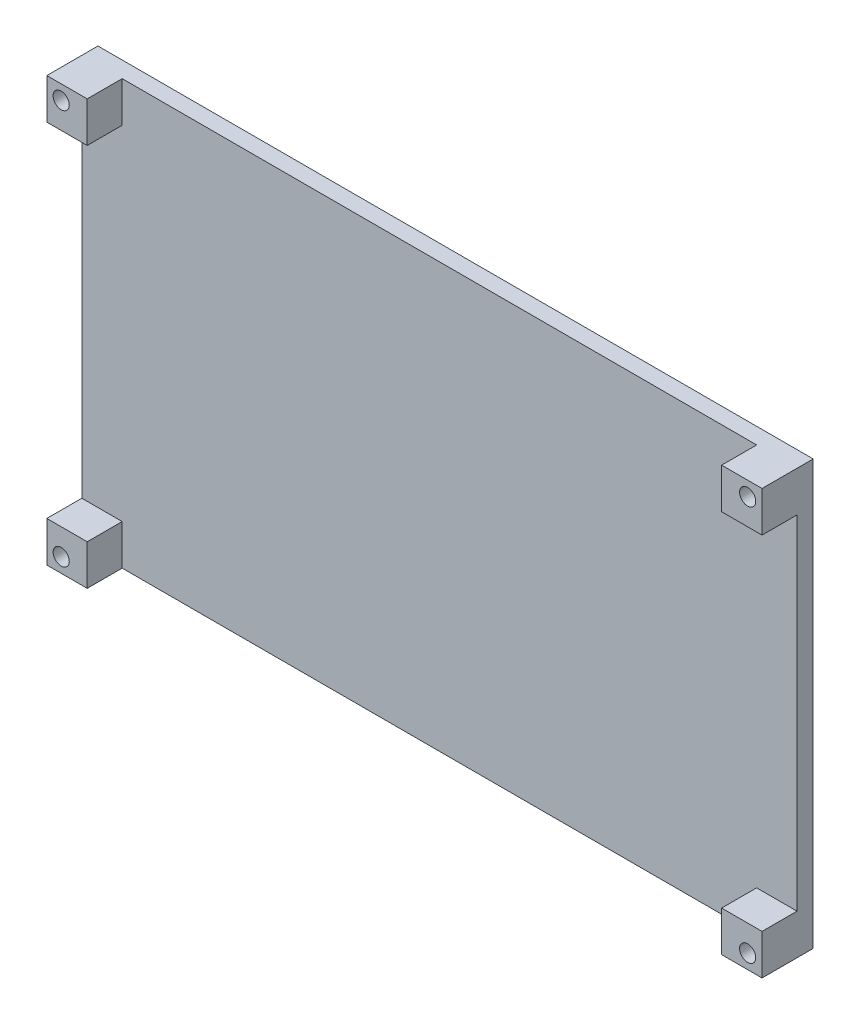
from build123d import *

# Parameters (mm, degrees)
SKETCH1_W               = 7.5
SKETCH1_H               = 7.5
SKETCH1_R               = 1.5
BOSS_EXTRUDE1_DEPTH     = 1.5
SKETCH1_3_W             = 7.5
SKETCH1_3_H             = 7.5
SKETCH1_3_R             = 1.5
BOSS_EXTRUDE2_DEPTH     = 8
SKETCH2_W               = 10
SKETCH2_H               = 25
BOSS_EXTRUDE3_DEPTH     = 35
CUT_EXTRUDE1_DEPTH      = 100.181515037
CUT_EXTRUDE1_DEPTH_BACK = 65
SKETCH4_R               = 2
CUT_EXTRUDE2_DEPTH      = 65
FILLET1_R               = 7.5


with BuildPart() as part:
    # Sketch1 → Boss-Extrude1 (new, symmetric)
    # profile 1 of 5: a face of its own
    with BuildSketch(Plane.XY):
        Polygon((-58.92, -31.87), (-58.92, -39.37), (58.92, -39.37), (58.92, -31.87), (66.42, -31.87), (66.42, 31.87), (58.92, 31.87), (58.92, 39.37), (-58.92, 39.37), (-58.92, 31.87), (-66.42, 31.87), (-66.42, -31.87), align=None)
    # profile 2 of 5: a face of its own
    with BuildSketch(Plane.XY):
        with Locations((-62.67, -35.62)):
            Rectangle(SKETCH1_W, SKETCH1_H)
        with Locations((-63.75, -36.7)):
            Circle(SKETCH1_R, mode=Mode.SUBTRACT)
    # profile 3 of 5: a face of its own
    with BuildSketch(Plane.XY):
        with Locations((-62.67, 35.62)):
            Rectangle(SKETCH1_W, SKETCH1_H)
        with Locations((-63.75, 36.7)):
            Circle(SKETCH1_R, mode=Mode.SUBTRACT)
    # profile 4 of 5: a face of its own
    with BuildSketch(Plane.XY):
        with Locations((62.67, 35.62)):
            Rectangle(SKETCH1_W, SKETCH1_H)
        with Locations((63.75, 36.7)):
            Circle(SKETCH1_R, mode=Mode.SUBTRACT)
    # profile 5 of 5: a face of its own
    with BuildSketch(Plane.XY):
        with Locations((62.67, -35.62)):
            Rectangle(SKETCH1_W, SKETCH1_H)
        with Locations((63.75, -36.7)):
            Circle(SKETCH1_R, mode=Mode.SUBTRACT)
    extrude(amount=BOSS_EXTRUDE1_DEPTH, both=True)

    # Sketch1<3> → Boss-Extrude2 (add)
    # profile 1 of 4: a face of its own
    with BuildSketch(Plane.XY):
        with Locations((-62.67, -35.62)):
            Rectangle(SKETCH1_3_W, SKETCH1_3_H)
        with Locations((-63.75, -36.7)):
            Circle(SKETCH1_3_R, mode=Mode.SUBTRACT)
    # profile 2 of 4: a face of its own
    with BuildSketch(Plane.XY):
        with Locations((-62.67, 35.62)):
            Rectangle(SKETCH1_3_W, SKETCH1_3_H)
        with Locations((-63.75, 36.7)):
            Circle(SKETCH1_3_R, mode=Mode.SUBTRACT)
    # profile 3 of 4: a face of its own
    with BuildSketch(Plane.XY):
        with Locations((62.67, 35.62)):
            Rectangle(SKETCH1_3_W, SKETCH1_3_H)
        with Locations((63.75, 36.7)):
            Circle(SKETCH1_3_R, mode=Mode.SUBTRACT)
    # profile 4 of 4: a face of its own
    with BuildSketch(Plane.XY):
        with Locations((62.67, -35.62)):
            Rectangle(SKETCH1_3_W, SKETCH1_3_H)
        with Locations((63.75, -36.7)):
            Circle(SKETCH1_3_R, mode=Mode.SUBTRACT)
    extrude(amount=BOSS_EXTRUDE2_DEPTH)

    # Sketch2 → Boss-Extrude3 (add)
    with BuildSketch(Plane(origin=(0, 0, -1.5), x_dir=(-1, 0, 0), z_dir=(0, 0, -1))):
        with Locations((-11.975, -26.87)):
            Rectangle(SKETCH2_W, SKETCH2_H)
        with Locations((11.975, -26.87)):
            Rectangle(SKETCH2_W, SKETCH2_H)
    extrude(amount=BOSS_EXTRUDE3_DEPTH)

    # Sketch3 → Cut-Extrude1 (cut, two sides: drawn at the far end of the back side and taken through both)
    with BuildSketch(Plane.ZY.offset(16.975).offset(-CUT_EXTRUDE1_DEPTH_BACK)):
        Polygon((-36.5, -14.37), (-36.5, -39.37), (-1.5, -14.37), align=None)
    extrude(amount=CUT_EXTRUDE1_DEPTH + CUT_EXTRUDE1_DEPTH_BACK, mode=Mode.SUBTRACT)

    # Sketch4 → Cut-Extrude2 (cut)
    with BuildSketch(Plane(origin=(16.975, 0, 0), x_dir=(0, 0, -1), z_dir=(1, 0, 0))):
        with Locations((16.5, -31.37)):
            Circle(SKETCH4_R)
    extrude(amount=-CUT_EXTRUDE2_DEPTH, mode=Mode.SUBTRACT)

    # Fillet1
    fillet1_edges = [part.edges().sort_by_distance(p)[0] for p in [
        (11.975, -39.37, -36.5),
        (-11.975, -39.37, -36.5),
    ]]
    fillet(fillet1_edges, radius=FILLET1_R)


solid = part.part
